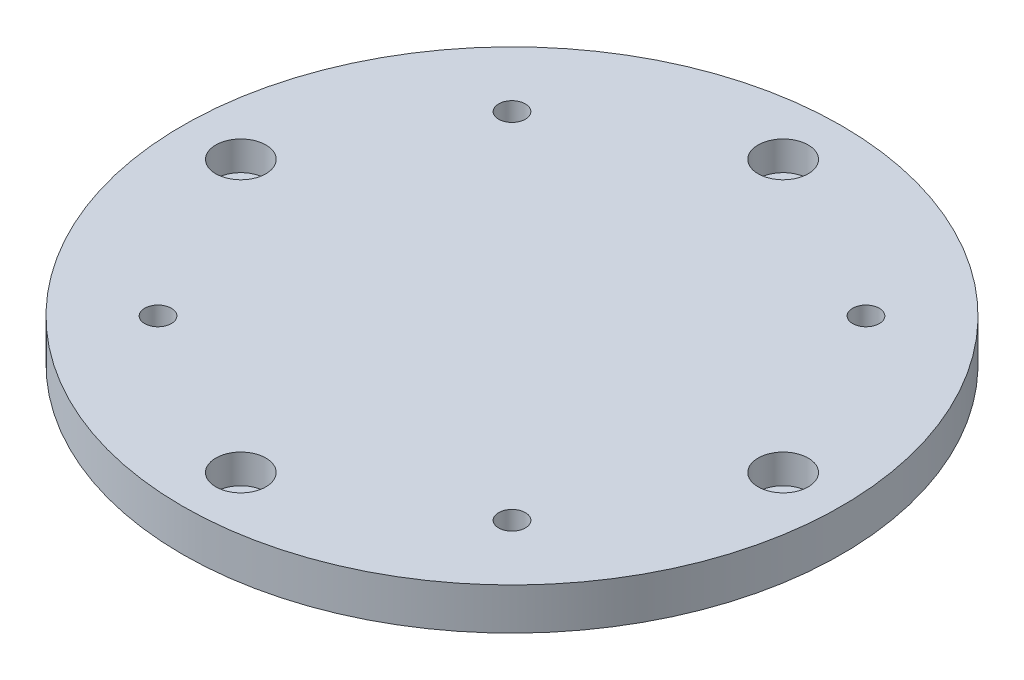
from build123d import *

# Parameters (mm, degrees)
SKETCH_1_R               = 39.5
EXTRUDE_1_DEPTH          = 5
CUT_EXTRUDE_1_DEPTH      = 57.084757288
CUT_EXTRUDE_1_DEPTH_BACK = 57.084757288
SKETCH_2_R               = 1.5
SKETCH_3_R               = 3
CUT_EXTRUDE_2_DEPTH      = 3.5
SKETCH_5_R               = 1.6
CUT_EXTRUDE_3_DEPTH      = 57.084757288


with BuildPart() as part:
    # 草图1 → 凸台-拉伸1 (new body)
    with BuildSketch(Plane(origin=(0, 0, 0), x_dir=(1, 0, 0), z_dir=(0, 1, 0))):
        with Locations(Location((0, 0, 0), (0, 0, 270))):
            Circle(SKETCH_1_R)
    extrude(amount=EXTRUDE_1_DEPTH)

    # 草图2 → 切除-拉伸1 (cut, two sides: drawn at the far end of the back side and taken through both)
    with BuildSketch(Plane(origin=(0, 5, 0), x_dir=(1, 0, 0), z_dir=(0, 1, 0)).offset(-CUT_EXTRUDE_1_DEPTH_BACK)):
        with Locations(Location((0, 32.5, 0), (0, 0, 270))):
            Circle(SKETCH_2_R)
        with Locations(Location((32.5, 0, 0), (0, 0, 270))):
            Circle(SKETCH_2_R)
        with Locations(Location((0, -32.5, 0), (0, 0, 270))):
            Circle(SKETCH_2_R)
        with Locations(Location((-32.5, 0, 0), (0, 0, 270))):
            Circle(SKETCH_2_R)
    extrude(amount=CUT_EXTRUDE_1_DEPTH + CUT_EXTRUDE_1_DEPTH_BACK, mode=Mode.SUBTRACT)

    # 草图3 → 切除-拉伸2 (cut)
    with BuildSketch(Plane(origin=(0, 5, 0), x_dir=(1, 0, 0), z_dir=(0, 1, 0))):
        with Locations(Location((-32.5, 0, 0), (0, 0, 270))):
            Circle(SKETCH_3_R)
        with Locations(Location((0, -32.5, 0), (0, 0, 270))):
            Circle(SKETCH_3_R)
        with Locations(Location((32.5, 0, 0), (0, 0, 270))):
            Circle(SKETCH_3_R)
        with Locations(Location((0, 32.5, 0), (0, 0, 270))):
            Circle(SKETCH_3_R)
    extrude(amount=-CUT_EXTRUDE_2_DEPTH, mode=Mode.SUBTRACT)

    # 草图5 → 切除-拉伸3 (cut, through all)
    with BuildSketch(Plane.XZ):
        with Locations(Location((21.213203436, 21.213203436, 0), (0, 0, 270))):
            Circle(SKETCH_5_R)
        with Locations(Location((21.213203436, -21.213203436, 0), (0, 0, 270))):
            Circle(SKETCH_5_R)
        with Locations(Location((-21.213203436, -21.213203436, 0), (0, 0, 270))):
            Circle(SKETCH_5_R)
        with Locations(Location((-21.213203436, 21.213203436, 0), (0, 0, 270))):
            Circle(SKETCH_5_R)
    extrude(amount=-CUT_EXTRUDE_3_DEPTH, mode=Mode.SUBTRACT)


solid = part.part
